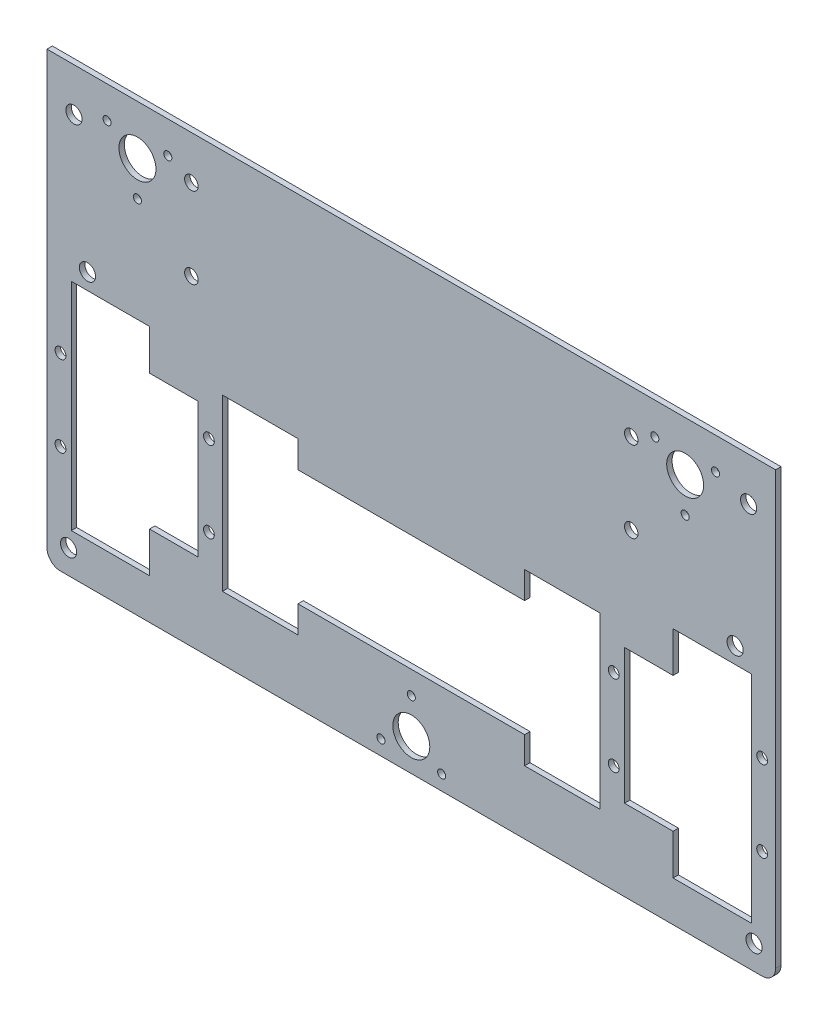
from build123d import *

# Parameters (mm, degrees)
SKETCH1_R             = 3
BOSS_EXTRUDE1_DEPTH   = 2
SKETCH6_R             = 3
BOSS_EXTRUDE2_DEPTH   = 2
BOSS_EXTRUDE2_2_DEPTH = 2
SKETCH7_R             = 1.5
SKETCH7_R_2           = 6.85
CUT_EXTRUDE4_DEPTH    = 10
SKETCH8_R             = 2
CUT_EXTRUDE5_DEPTH    = 175.152232257
SKETCH9_R             = 2.5
CUT_EXTRUDE6_DEPTH    = 10
CUT_EXTRUDE7_DEPTH    = 10
FILLET1_R             = 5


with BuildPart() as part:
    # Sketch1 → Boss-Extrude1 (new body)
    with BuildSketch(Plane.XY):
        Polygon((-135, -20.635083269), (-135, -50), (135, -50), (135, -20.635083269), (135, 40), (135, 50), (-135, 50), (-135, 40), align=None)
        with Locations((-127, -46)):
            Circle(SKETCH1_R, mode=Mode.SUBTRACT)
        with Locations((-120, 46)):
            Circle(SKETCH1_R, mode=Mode.SUBTRACT)
        with Locations((120, 46)):
            Circle(SKETCH1_R, mode=Mode.SUBTRACT)
        with Locations((127, -46)):
            Circle(SKETCH1_R, mode=Mode.SUBTRACT)
        Polygon((-126, 40), (-97, 40), (-97, 25), (-79, 25), (-79, -25), (-97, -25), (-97, -40), (-126, -40), align=None, mode=Mode.SUBTRACT)
        Polygon((-70, -31.5), (-42, -31.5), (-42, -21.5), (-4, -21.5), (4, -21.5), (42, -21.5), (42, -31.5), (70, -31.5), (70, 31.5), (42, 31.5), (42, 21.5), (4, 21.5), (-4, 21.5), (-42, 21.5), (-42, 31.5), (-70, 31.5), align=None, mode=Mode.SUBTRACT)
        Polygon((97, -40), (126, -40), (126, 40), (97, 40), (97, 25), (79, 25), (79, -25), (97, -25), align=None, mode=Mode.SUBTRACT)
    extrude(amount=BOSS_EXTRUDE1_DEPTH)


with BuildPart() as body_2:
    # Sketch6 → Boss-Extrude2 (new body)
    with BuildSketch(Plane.XY.offset(2)):
        Polygon((75, 110), (135, 110), (135, 50), (-135, 50), (-135, 110), align=None)
        with Locations((-125, 94)):
            Circle(SKETCH6_R, mode=Mode.SUBTRACT)
        with Locations((125, 94)):
            Circle(SKETCH6_R, mode=Mode.SUBTRACT)
    extrude(amount=-BOSS_EXTRUDE2_DEPTH)

    # Combine1: union part
    add(part.part)


with BuildPart() as body_3:
    # Sketch6 → Boss-Extrude2 2 (new body)
    with BuildSketch(Plane.XY.offset(2)):
        with BuildLine():
            Line((-135, -50), (135, -50))
            Line((135, -50), (135, -55))
            ThreePointArc((135, -55), (133.535533906, -58.535533906), (130, -60))
            Line((130, -60), (-130, -60))
            ThreePointArc((-130, -60), (-133.535533906, -58.535533906), (-135, -55))
            Line((-135, -55), (-135, -50))
        make_face()
    extrude(amount=-BOSS_EXTRUDE2_2_DEPTH)


with BuildPart() as body_2_1:
    add(body_2.part)

    # Combine2: union body 3
    add(body_3.part)

    # Sketch7 → Cut-Extrude4 (cut)
    with BuildSketch(Plane.XY.offset(2)):
        with Locations((11.25, -49.495190528)):
            Circle(SKETCH7_R)
        with Locations((-11.25, -49.495190528)):
            Circle(SKETCH7_R)
        with Locations((0, -30.009618943)):
            Circle(SKETCH7_R)
        with Locations((90.234667928, 98.180240786)):
            Circle(SKETCH7_R)
        with Locations((0, -43)):
            Circle(SKETCH7_R_2)
        with Locations((112.734667928, 98.180240786)):
            Circle(SKETCH7_R)
        with Locations((101.484667928, 78.6946692)):
            Circle(SKETCH7_R)
        with Locations((101.484667928, 91.685050257)):
            Circle(SKETCH7_R_2)
        with Locations((-101.484667928, 91.685050257)):
            Circle(SKETCH7_R_2)
        with Locations((-101.484667928, 78.6946692)):
            Circle(SKETCH7_R)
        with Locations((-112.734667928, 98.180240786)):
            Circle(SKETCH7_R)
        with Locations((-90.234667928, 98.180240786)):
            Circle(SKETCH7_R)
    extrude(amount=-CUT_EXTRUDE4_DEPTH, mode=Mode.SUBTRACT)

    # Sketch8 → Cut-Extrude5 (cut, through all)
    with BuildSketch(Plane(origin=(0, 0, 0), x_dir=(-1, 0, 0), z_dir=(0, 0, -1))):
        with Locations((-130, -15)):
            Circle(SKETCH8_R)
        with Locations((-130, 15)):
            Circle(SKETCH8_R)
        with Locations((-75, -15)):
            Circle(SKETCH8_R)
        with Locations((-75, 15)):
            Circle(SKETCH8_R)
        with Locations((75, -15)):
            Circle(SKETCH8_R)
        with Locations((75, 15)):
            Circle(SKETCH8_R)
        with Locations((130, -15)):
            Circle(SKETCH8_R)
        with Locations((130, 15)):
            Circle(SKETCH8_R)
    extrude(amount=-CUT_EXTRUDE5_DEPTH, mode=Mode.SUBTRACT)

    # Sketch9 → Cut-Extrude6 (cut)
    with BuildSketch(Plane(origin=(0, 0, 0), x_dir=(-1, 0, 0), z_dir=(0, 0, -1))):
        with Locations((81.5, 93.898069018)):
            Circle(SKETCH9_R)
        with Locations((81.5, 63.898069018)):
            Circle(SKETCH9_R)
        with Locations((-81.5, 93.898069018)):
            Circle(SKETCH9_R)
        with Locations((-81.5, 63.898069018)):
            Circle(SKETCH9_R)
    extrude(amount=-CUT_EXTRUDE6_DEPTH, mode=Mode.SUBTRACT)

    # Sketch10 → Cut-Extrude7 (cut)
    with BuildSketch(Plane.XY.offset(2)):
        with BuildLine():
            Line((-130, -60), (130, -60))
            ThreePointArc((130, -60), (133.535533906, -58.535533906), (135, -55))
            Line((135, -55), (-135, -55))
            ThreePointArc((-135, -55), (-133.535533906, -58.535533906), (-130, -60))
        make_face()
    extrude(amount=-CUT_EXTRUDE7_DEPTH, mode=Mode.SUBTRACT)

    # Fillet1
    fillet1_edges = [body_2_1.edges().sort_by_distance(p)[0] for p in [
        (135, -55, 1),
        (-135, -55, 1),
    ]]
    fillet(fillet1_edges, radius=FILLET1_R)


solid = body_2_1.part
